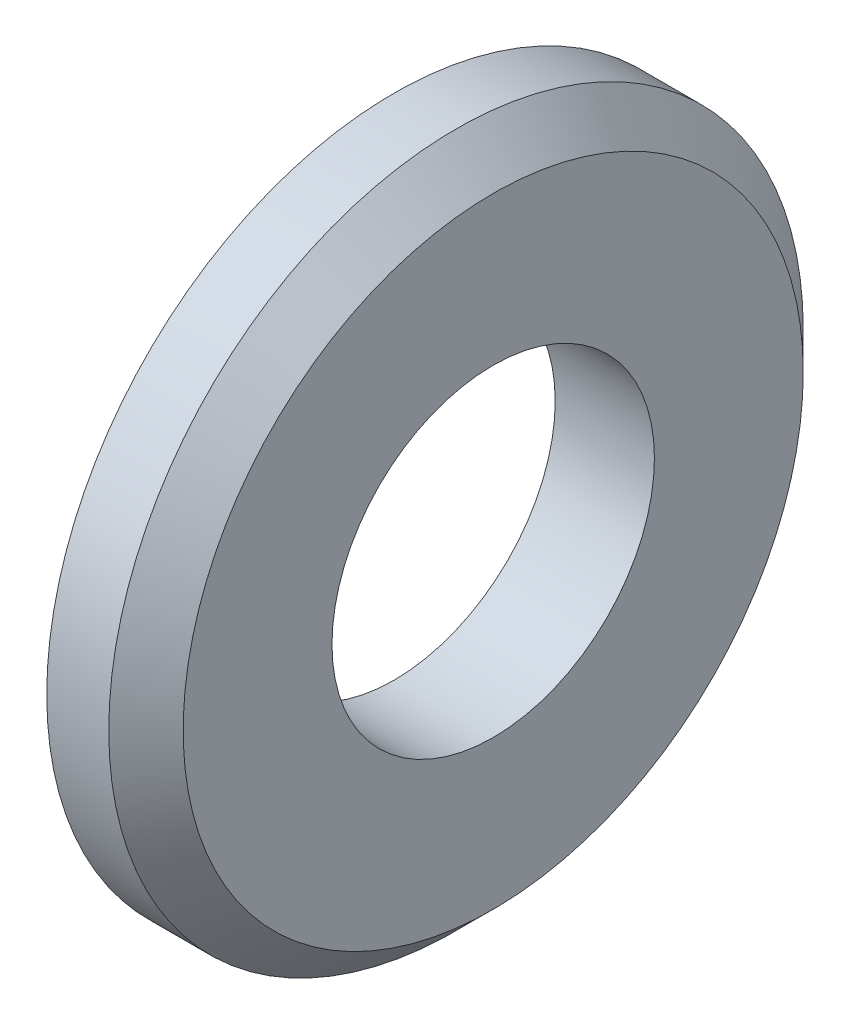
from build123d import *

# Parameters (mm, degrees)
SKETCH_1_W     = 4
SKETCH_1_H     = 7.5
CHAMFER_2_SIZE = 1.5


with BuildPart() as part:
    # 草图1 → 旋转1 (revolve)
    with BuildSketch(Plane.XY, mode=Mode.PRIVATE) as revolve_1_sk:
        with Locations((-2, 10.25)):
            Rectangle(SKETCH_1_W, SKETCH_1_H)
    revolve(revolve_1_sk.sketch.rotate(Axis((0, 0, 0), (-1, 0, 0)), 90), axis=Axis((0, 0, 0), (-1, 0, 0)))

    # 倒角2
    chamfer_2_edges = [part.edges().sort_by_distance(p)[0] for p in [
        (0, 0, 14),
    ]]
    chamfer(chamfer_2_edges, length=CHAMFER_2_SIZE)


solid = part.part
